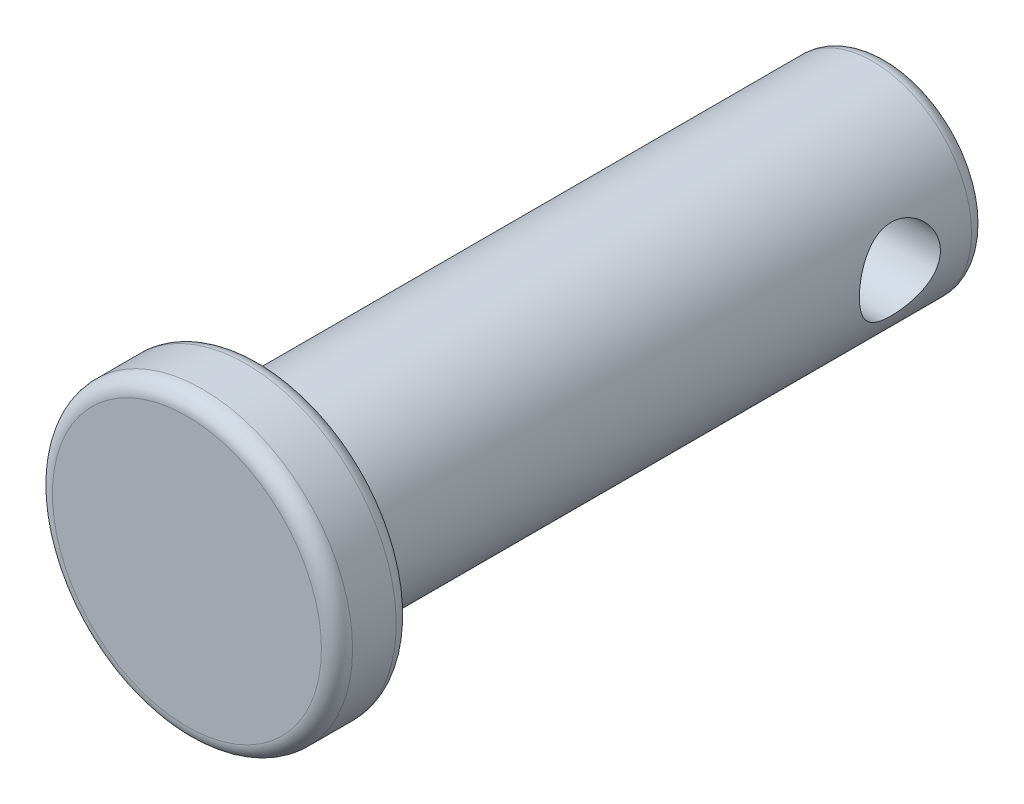
from build123d import *

# Parameters (mm, degrees)
CUT_EXTRUDE1_DEPTH      = 54.63402325
CUT_EXTRUDE1_DEPTH_BACK = 54.63402325
SKETCH2_R               = 1.3
F7F_R                   = 0.5
CUT_EXTRUDE2_DEPTH      = 54.634023349
CUT_EXTRUDE2_DEPTH_BACK = 54.634023349
SKETCH3_W               = 6.35
SKETCH3_H               = 30.7
FILLET1_R               = 0.5


with BuildPart() as part:
    # Sketch1 → Revolve1 (revolve)
    with BuildSketch(Plane.YZ, mode=Mode.PRIVATE) as revolve1_sk:
        Polygon((0, 0), (4.815, 0), (4.815, -2.4), (3.175, -2.4), (3.175, -53.2), (0, -53.2), align=None)
    revolve(revolve1_sk.sketch.rotate(Axis((0, 0, -335.576810525), (0, 0, 1)), 90), axis=Axis((0, 0, -335.576810525), (0, 0, 1)))

    # Sketch2 → Cut-Extrude1 (cut, two sides: drawn at the far end of the back side and taken through both)
    with BuildSketch(Plane.YZ.offset(-CUT_EXTRUDE1_DEPTH_BACK)):
        with Locations(Location((0, -47.7, 0), (0, 0, 270.000000002))):
            Circle(SKETCH2_R)
        with Locations(Location((0, -42.1, 0), (0, 0, 270.000000002))):
            Circle(SKETCH2_R)
        with Locations(Location((0, -25.3, 0), (0, 0, 270.000000002))):
            Circle(SKETCH2_R)
        with Locations(Location((0, -30.9, 0), (0, 0, 270.000000002))):
            Circle(SKETCH2_R)
        with Locations(Location((0, -36.5, 0), (0, 0, 270.000000002))):
            Circle(SKETCH2_R)
        with Locations(Location((0, -19.7, 0), (0, 0, 270.000000002))):
            Circle(SKETCH2_R)
    extrude(amount=CUT_EXTRUDE1_DEPTH + CUT_EXTRUDE1_DEPTH_BACK, mode=Mode.SUBTRACT)

    # f7f
    f7f_edges = [part.edges().sort_by_distance(p)[0] for p in [
        (4.815, 0, -2.4),
        (4.815, 0, 0),
    ]]
    fillet(f7f_edges, radius=F7F_R)

    # Sketch3 → Cut-Extrude2 (cut, two sides: drawn at the far end of the back side and taken through both)
    with BuildSketch(Plane.YZ.offset(-CUT_EXTRUDE2_DEPTH_BACK)):
        with Locations((0, -37.85)):
            Rectangle(SKETCH3_W, SKETCH3_H)
    extrude(amount=CUT_EXTRUDE2_DEPTH + CUT_EXTRUDE2_DEPTH_BACK, mode=Mode.SUBTRACT)

    # Fillet1
    fillet1_edges = [part.edges().sort_by_distance(p)[0] for p in [
        (3.175, 0, -22.5),
    ]]
    fillet(fillet1_edges, radius=FILLET1_R)


solid = part.part
